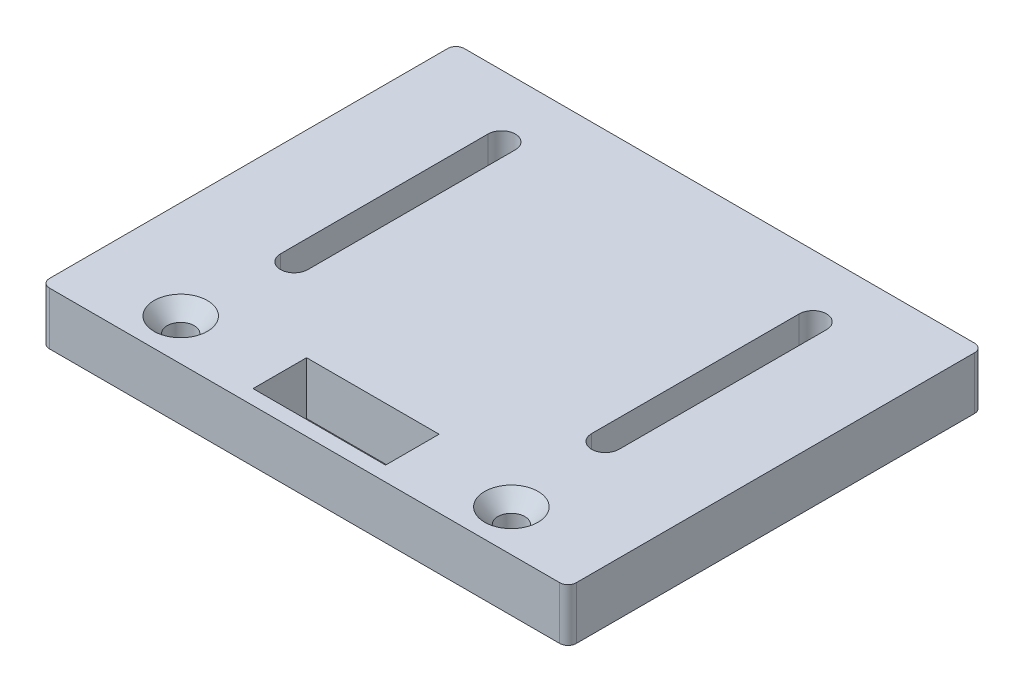
from build123d import *

# Parameters (mm, degrees)
SKETCH1_W                                        = 127
SKETCH1_H                                        = 100
BOSS_EXTRUDE1_DEPTH                              = 12.7
CUT_EXTRUDE1_DEPTH                               = 12.7
CUT_EXTRUDE2_DEPTH                               = 163.142807426
FILLET1_R                                        = 2
CSK_FOR_1_4_FLAT_HEAD_MACHINE_SCREW1_D           = 6.5278
CSK_FOR_1_4_FLAT_HEAD_MACHINE_SCREW1_CSINK_D     = 12.8778
CSK_FOR_1_4_FLAT_HEAD_MACHINE_SCREW1_CSINK_ANGLE = 82


with BuildPart() as part:
    # Sketch1 → Boss-Extrude1 (new body)
    with BuildSketch(Plane(origin=(0, 0, 0), x_dir=(1, 0, 0), z_dir=(0, 1, 0))):
        with Locations((63.5, 50)):
            Rectangle(SKETCH1_W, SKETCH1_H)
    extrude(amount=BOSS_EXTRUDE1_DEPTH)

    # Sketch2 → Cut-Extrude1 (cut)
    with BuildSketch(Plane(origin=(0, 12.7, 0), x_dir=(1, 0, 0), z_dir=(0, 1, 0))):
        Polygon((47.53, 10), (47.53, 16.45), (79.48, 16.45), (79.48, 10), (79.48, 3.55), (47.53, 3.55), align=None)
    extrude(amount=-CUT_EXTRUDE1_DEPTH, mode=Mode.SUBTRACT)

    # Sketch6 → Cut-Extrude2 (cut, through all)
    with BuildSketch(Plane(origin=(0, 12.7, 0), x_dir=(1, 0, 0), z_dir=(0, 1, 0))):
        with BuildLine():
            Line((22.7, 35), (22.7, 85))
            ThreePointArc((22.7, 85), (26, 88.3), (29.3, 85))
            Line((29.3, 85), (29.3, 35))
            ThreePointArc((29.3, 35), (26, 31.7), (22.7, 35))
        make_face()
        with BuildLine():
            Line((97.721270275, 34.979203261), (97.751665409, 84.979194023))
            ThreePointArc((97.751665409, 84.979194023), (101.053670878, 88.277187334), (104.351664189, 84.975181865))
            Line((104.351664189, 84.975181865), (104.321269055, 34.975191104))
            ThreePointArc((104.321269055, 34.975191104), (101.019263586, 31.677197792), (97.721270275, 34.979203261))
        make_face()
    extrude(amount=-CUT_EXTRUDE2_DEPTH, mode=Mode.SUBTRACT)

    # Fillet1
    fillet1_edges = [part.edges().sort_by_distance(p)[0] for p in [
        (0, 6.35, -100),
        (127, 6.35, -100),
        (127, 6.35, 0),
        (0, 6.35, 0),
    ]]
    fillet(fillet1_edges, radius=FILLET1_R)

    # CSK for 1/4 Flat Head Machine Screw1 (through all)
    with Locations(Plane(origin=(23.65, 12.7, -9.996892397), x_dir=(0, 0, 1), z_dir=(0, 1, 0))):
        with Locations((0, 0), (0, 79.7)):
            CounterSinkHole(CSK_FOR_1_4_FLAT_HEAD_MACHINE_SCREW1_D / 2, CSK_FOR_1_4_FLAT_HEAD_MACHINE_SCREW1_CSINK_D / 2, counter_sink_angle=CSK_FOR_1_4_FLAT_HEAD_MACHINE_SCREW1_CSINK_ANGLE)


solid = part.part
